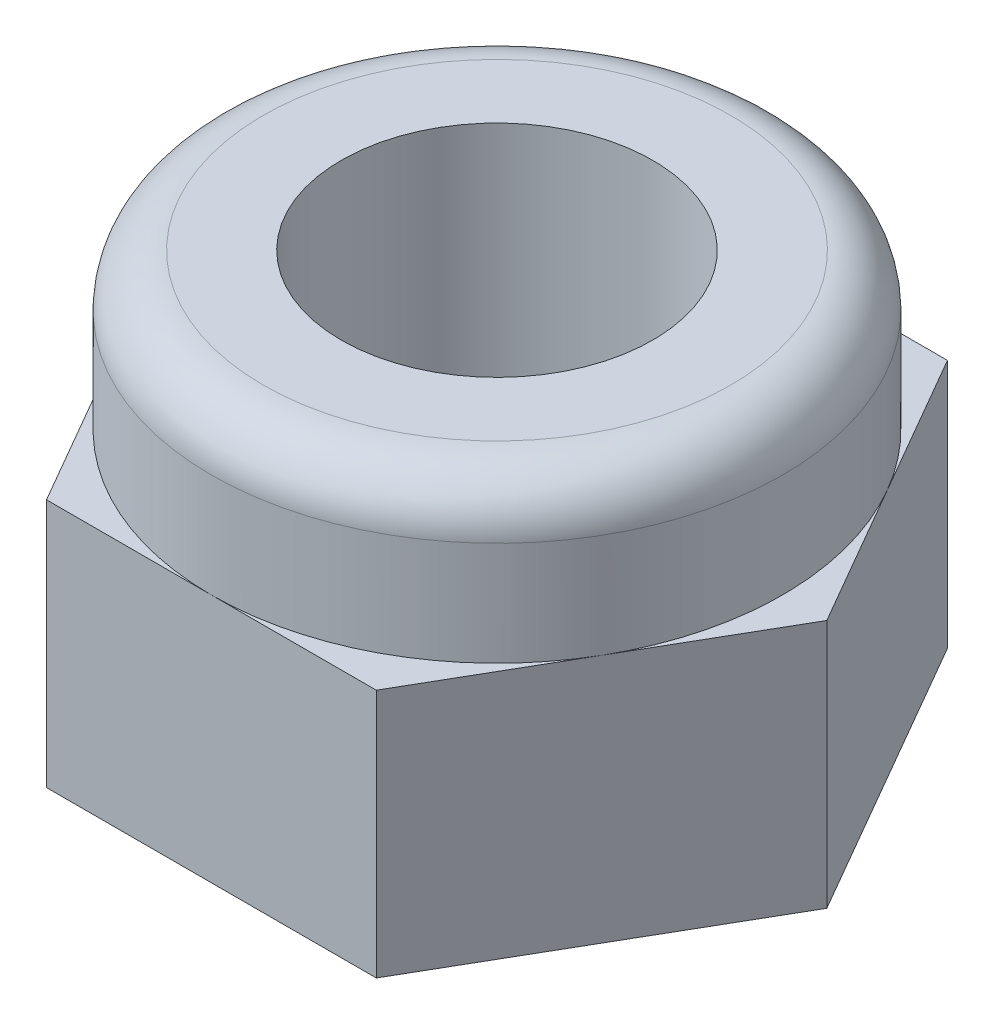
from build123d import *

# Parameters (mm, degrees)
EXTRUDE_1_DEPTH     = 2.4
SKETCH_2_R          = 2.75
EXTRUDE_2_DEPTH     = 1.5
SKETCH_3_R          = 1.5
CUT_EXTRUDE_1_DEPTH = 6.732000814
FILLET_1_R          = 0.5


with BuildPart() as part:
    # 草图1 → 凸台-拉伸1 (new body)
    with BuildSketch(Plane(origin=(0, 0, 0), x_dir=(1, 0, 0), z_dir=(0, 1, 0))):
        Polygon((3.175426481, 0), (1.58771324, 2.75), (-1.58771324, 2.75), (-3.175426481, 0), (-1.58771324, -2.75), (1.58771324, -2.75), align=None)
    extrude(amount=EXTRUDE_1_DEPTH)

    # 草图2 → 凸台-拉伸2 (add)
    with BuildSketch(Plane(origin=(0, 2.4, 0), x_dir=(1, 0, 0), z_dir=(0, 1, 0))):
        with Locations(Location((0, 0, 0), (0, 0, 270))):
            Circle(SKETCH_2_R)
    extrude(amount=EXTRUDE_2_DEPTH)

    # 草图3 → 切除-拉伸1 (cut, through all)
    with BuildSketch(Plane(origin=(0, 3.9, 0), x_dir=(1, 0, 0), z_dir=(0, 1, 0))):
        with Locations(Location((0, 0, 0), (0, 0, 270))):
            Circle(SKETCH_3_R)
    extrude(amount=-CUT_EXTRUDE_1_DEPTH, mode=Mode.SUBTRACT)

    # 圆角1
    fillet_1_edges = [part.edges().sort_by_distance(p)[0] for p in [
        (0, 3.9, -2.75),
    ]]
    fillet(fillet_1_edges, radius=FILLET_1_R)


solid = part.part
